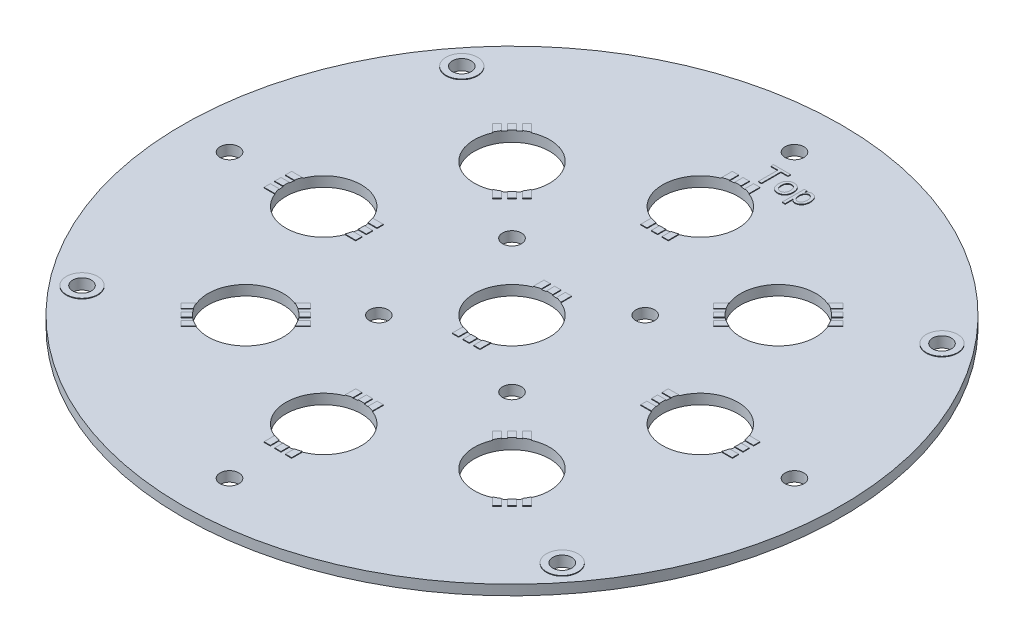
from build123d import *

# Parameters (mm, degrees)
SKETCH2_R                          = 52.5
SKETCH2_R_2                        = 1.5
PCB_1_6MM_BOSS_EXTRUDE1_DEPTH      = 1.6
SKETCH3_W                          = 1
SKETCH3_H                          = 14.6
SKETCH3_W_2                        = 14.6
SKETCH3_H_2                        = 1
PADS_BOSS_EXTRUDE2_DEPTH           = 0.1
LED_HOLES_CUT_EXTRUDE2_REACH       = 76.266
SKETCH4_R                          = 6
SKETCH5_R                          = 2.5
SKETCH5_R_2                        = 1.5
HEATSINK_HOLES_BOSS_EXTRUDE1_DEPTH = 0.1


with BuildPart() as part:
    # Sketch2 → PCB 1.6mm Boss-Extrude1 (new body)
    with BuildSketch(Plane(origin=(0, 0, 0), x_dir=(1, 0, 0), z_dir=(0, 1, 0))):
        with Locations(Location((0, 0, 0), (0, 0, 270))):
            Circle(SKETCH2_R)
        with Locations(Location((-38.25, 30.25, 0), (0, 0, 270))):
            Circle(SKETCH2_R_2, mode=Mode.SUBTRACT)
        with Locations(Location((38.25, 30.25, 0), (0, 0, 270))):
            Circle(SKETCH2_R_2, mode=Mode.SUBTRACT)
        with Locations(Location((38.25, -30.25, 0), (0, 0, 270))):
            Circle(SKETCH2_R_2, mode=Mode.SUBTRACT)
        with Locations(Location((-38.25, -30.25, 0), (0, 0, 270))):
            Circle(SKETCH2_R_2, mode=Mode.SUBTRACT)
        with Locations(Location((0, 45, 0), (0, 0, 270))):
            Circle(SKETCH2_R_2, mode=Mode.SUBTRACT)
        with Locations(Location((45, 0, 0), (0, 0, 270))):
            Circle(SKETCH2_R_2, mode=Mode.SUBTRACT)
        with Locations(Location((0, -45, 0), (0, 0, 270))):
            Circle(SKETCH2_R_2, mode=Mode.SUBTRACT)
        with Locations(Location((-45, 0, 0), (0, 0, 270))):
            Circle(SKETCH2_R_2, mode=Mode.SUBTRACT)
        with Locations(Location((-10.606601718, 10.606601718, 0), (0, 0, 270))):
            Circle(SKETCH2_R_2, mode=Mode.SUBTRACT)
        with Locations(Location((10.606601718, 10.606601718, 0), (0, 0, 270))):
            Circle(SKETCH2_R_2, mode=Mode.SUBTRACT)
        with Locations(Location((10.606601718, -10.606601718, 0), (0, 0, 270))):
            Circle(SKETCH2_R_2, mode=Mode.SUBTRACT)
        with Locations(Location((-10.606601718, -10.606601718, 0), (0, 0, 270))):
            Circle(SKETCH2_R_2, mode=Mode.SUBTRACT)
    extrude(amount=PCB_1_6MM_BOSS_EXTRUDE1_DEPTH)

    # Sketch3 → Pads Boss-Extrude2 (add)
    with BuildSketch(Plane(origin=(0, 1.6, 0), x_dir=(1, 0, 0), z_dir=(0, 1, 0))):
        with Locations((-1.7, 30)):
            Rectangle(SKETCH3_W, SKETCH3_H)
        with Locations((1.7, 30)):
            Rectangle(SKETCH3_W, SKETCH3_H)
        with Locations((-1.7, 0)):
            Rectangle(SKETCH3_W, SKETCH3_H)
        with Locations((1.7, 0)):
            Rectangle(SKETCH3_W, SKETCH3_H)
        with Locations((0, 30)):
            Rectangle(SKETCH3_W, SKETCH3_H)
        Rectangle(SKETCH3_W, SKETCH3_H)
        Polygon((24.81944802, 27.930717857), (14.495689014, 17.606958852), (15.202795796, 16.89985207), (25.526554801, 27.223611076), align=None)
        Polygon((26.021529548, 26.728636329), (15.697770542, 16.404877324), (16.404877324, 15.697770542), (26.728636329, 26.021529548), align=None)
        Polygon((27.223611076, 25.526554801), (16.89985207, 15.202795796), (17.606958852, 14.495689014), (27.930717857, 24.81944802), align=None)
        with Locations((30, 1.7)):
            Rectangle(SKETCH3_W_2, SKETCH3_H_2)
        with Locations((30, 0)):
            Rectangle(SKETCH3_W_2, SKETCH3_H_2)
        with Locations((30, -1.7)):
            Rectangle(SKETCH3_W_2, SKETCH3_H_2)
        Polygon((27.930717857, -24.81944802), (17.606958852, -14.495689014), (16.89985207, -15.202795796), (27.223611076, -25.526554801), align=None)
        Polygon((26.728636329, -26.021529548), (16.404877324, -15.697770542), (15.697770542, -16.404877324), (26.021529548, -26.728636329), align=None)
        Polygon((25.526554801, -27.223611076), (15.202795796, -16.89985207), (14.495689014, -17.606958852), (24.81944802, -27.930717857), align=None)
        with Locations((1.7, -30)):
            Rectangle(SKETCH3_W, SKETCH3_H)
        with Locations((0, -30)):
            Rectangle(SKETCH3_W, SKETCH3_H)
        with Locations((-1.7, -30)):
            Rectangle(SKETCH3_W, SKETCH3_H)
        Polygon((-24.81944802, -27.930717857), (-14.495689014, -17.606958852), (-15.202795796, -16.89985207), (-25.526554801, -27.223611076), align=None)
        Polygon((-26.021529548, -26.728636329), (-15.697770542, -16.404877324), (-16.404877324, -15.697770542), (-26.728636329, -26.021529548), align=None)
        Polygon((-27.223611076, -25.526554801), (-16.89985207, -15.202795796), (-17.606958852, -14.495689014), (-27.930717857, -24.81944802), align=None)
        with Locations((-30, -1.7)):
            Rectangle(SKETCH3_W_2, SKETCH3_H_2)
        with Locations((-30, 0)):
            Rectangle(SKETCH3_W_2, SKETCH3_H_2)
        with Locations((-30, 1.7)):
            Rectangle(SKETCH3_W_2, SKETCH3_H_2)
        Polygon((-27.930717857, 24.81944802), (-17.606958852, 14.495689014), (-16.89985207, 15.202795796), (-27.223611076, 25.526554801), align=None)
        Polygon((-26.728636329, 26.021529548), (-16.404877324, 15.697770542), (-15.697770542, 16.404877324), (-26.021529548, 26.728636329), align=None)
        Polygon((-25.526554801, 27.223611076), (-15.202795796, 16.89985207), (-14.495689014, 17.606958852), (-24.81944802, 27.930717857), align=None)
    extrude(amount=PADS_BOSS_EXTRUDE2_DEPTH)

    # LED Holes Cut-Extrude2: up to this face of the body (flat: up to its plane)
    led_holes_cut_extrude2_end = Plane(part.part.faces().sort_by_distance((-22.415284964, 1.7, -20.011121908))[0])
    # Sketch4 → LED Holes Cut-Extrude2 (cut, up to the picked face)
    with BuildSketch(Plane(origin=(0, 0, 0), x_dir=(1, 0, 0), z_dir=(0, 1, 0)), mode=Mode.PRIVATE) as led_holes_cut_extrude2_sk1:
        with Locations(Location((0, 0, 0), (0, 0, 85.219808153))):
            Circle(SKETCH4_R)
    led_holes_cut_extrude2_tool1 = split(extrude(led_holes_cut_extrude2_sk1.sketch, amount=LED_HOLES_CUT_EXTRUDE2_REACH, mode=Mode.PRIVATE), bisect_by=led_holes_cut_extrude2_end, keep=Keep.BOTH, mode=Mode.PRIVATE)
    # Sketch4 → LED Holes Cut-Extrude2 (cut, up to the picked face)
    with BuildSketch(Plane(origin=(0, 0, 0), x_dir=(1, 0, 0), z_dir=(0, 1, 0)), mode=Mode.PRIVATE) as led_holes_cut_extrude2_sk2:
        with Locations(Location((0, 30, 0), (0, 0, 85.219808153))):
            Circle(SKETCH4_R)
    led_holes_cut_extrude2_tool2 = split(extrude(led_holes_cut_extrude2_sk2.sketch, amount=LED_HOLES_CUT_EXTRUDE2_REACH, mode=Mode.PRIVATE), bisect_by=led_holes_cut_extrude2_end, keep=Keep.BOTH, mode=Mode.PRIVATE)
    # Sketch4 → LED Holes Cut-Extrude2 (cut, up to the picked face)
    with BuildSketch(Plane(origin=(0, 0, 0), x_dir=(1, 0, 0), z_dir=(0, 1, 0)), mode=Mode.PRIVATE) as led_holes_cut_extrude2_sk3:
        with Locations(Location((21.213203436, 21.213203436, 0), (0, 0, 66.510188267))):
            Circle(SKETCH4_R)
    led_holes_cut_extrude2_tool3 = split(extrude(led_holes_cut_extrude2_sk3.sketch, amount=LED_HOLES_CUT_EXTRUDE2_REACH, mode=Mode.PRIVATE), bisect_by=led_holes_cut_extrude2_end, keep=Keep.BOTH, mode=Mode.PRIVATE)
    # Sketch4 → LED Holes Cut-Extrude2 (cut, up to the picked face)
    with BuildSketch(Plane(origin=(0, 0, 0), x_dir=(1, 0, 0), z_dir=(0, 1, 0)), mode=Mode.PRIVATE) as led_holes_cut_extrude2_sk4:
        with Locations(Location((30, 0, 0), (0, 0, 158.489811733))):
            Circle(SKETCH4_R)
    led_holes_cut_extrude2_tool4 = split(extrude(led_holes_cut_extrude2_sk4.sketch, amount=LED_HOLES_CUT_EXTRUDE2_REACH, mode=Mode.PRIVATE), bisect_by=led_holes_cut_extrude2_end, keep=Keep.BOTH, mode=Mode.PRIVATE)
    # Sketch4 → LED Holes Cut-Extrude2 (cut, up to the picked face)
    with BuildSketch(Plane(origin=(0, 0, 0), x_dir=(1, 0, 0), z_dir=(0, 1, 0)), mode=Mode.PRIVATE) as led_holes_cut_extrude2_sk5:
        with Locations(Location((21.213203436, -21.213203436, 0), (0, 0, 113.489811733))):
            Circle(SKETCH4_R)
    led_holes_cut_extrude2_tool5 = split(extrude(led_holes_cut_extrude2_sk5.sketch, amount=LED_HOLES_CUT_EXTRUDE2_REACH, mode=Mode.PRIVATE), bisect_by=led_holes_cut_extrude2_end, keep=Keep.BOTH, mode=Mode.PRIVATE)
    # Sketch4 → LED Holes Cut-Extrude2 (cut, up to the picked face)
    with BuildSketch(Plane(origin=(0, 0, 0), x_dir=(1, 0, 0), z_dir=(0, 1, 0)), mode=Mode.PRIVATE) as led_holes_cut_extrude2_sk6:
        with Locations(Location((0, -30, 0), (0, 0, 94.780191847))):
            Circle(SKETCH4_R)
    led_holes_cut_extrude2_tool6 = split(extrude(led_holes_cut_extrude2_sk6.sketch, amount=LED_HOLES_CUT_EXTRUDE2_REACH, mode=Mode.PRIVATE), bisect_by=led_holes_cut_extrude2_end, keep=Keep.BOTH, mode=Mode.PRIVATE)
    # Sketch4 → LED Holes Cut-Extrude2 (cut, up to the picked face)
    with BuildSketch(Plane(origin=(0, 0, 0), x_dir=(1, 0, 0), z_dir=(0, 1, 0)), mode=Mode.PRIVATE) as led_holes_cut_extrude2_sk7:
        with Locations(Location((-21.213203436, -21.213203436, 0), (0, 0, 66.510188267))):
            Circle(SKETCH4_R)
    led_holes_cut_extrude2_tool7 = split(extrude(led_holes_cut_extrude2_sk7.sketch, amount=LED_HOLES_CUT_EXTRUDE2_REACH, mode=Mode.PRIVATE), bisect_by=led_holes_cut_extrude2_end, keep=Keep.BOTH, mode=Mode.PRIVATE)
    # Sketch4 → LED Holes Cut-Extrude2 (cut, up to the picked face)
    with BuildSketch(Plane(origin=(0, 0, 0), x_dir=(1, 0, 0), z_dir=(0, 1, 0)), mode=Mode.PRIVATE) as led_holes_cut_extrude2_sk8:
        with Locations(Location((-30, 0, 0), (0, 0, 21.510188267))):
            Circle(SKETCH4_R)
    led_holes_cut_extrude2_tool8 = split(extrude(led_holes_cut_extrude2_sk8.sketch, amount=LED_HOLES_CUT_EXTRUDE2_REACH, mode=Mode.PRIVATE), bisect_by=led_holes_cut_extrude2_end, keep=Keep.BOTH, mode=Mode.PRIVATE)
    # Sketch4 → LED Holes Cut-Extrude2 (cut, up to the picked face)
    with BuildSketch(Plane(origin=(0, 0, 0), x_dir=(1, 0, 0), z_dir=(0, 1, 0)), mode=Mode.PRIVATE) as led_holes_cut_extrude2_sk9:
        with Locations(Location((-21.213203436, 21.213203436, 0), (0, 0, 113.489811733))):
            Circle(SKETCH4_R)
    led_holes_cut_extrude2_tool9 = split(extrude(led_holes_cut_extrude2_sk9.sketch, amount=LED_HOLES_CUT_EXTRUDE2_REACH, mode=Mode.PRIVATE), bisect_by=led_holes_cut_extrude2_end, keep=Keep.BOTH, mode=Mode.PRIVATE)
    add(led_holes_cut_extrude2_tool1.solids().sort_by(Axis((0, 0, 0), (0, 1, 0)))[0], mode=Mode.SUBTRACT)
    add(led_holes_cut_extrude2_tool2.solids().sort_by(Axis((0, 0, -30), (0, 1, 0)))[0], mode=Mode.SUBTRACT)
    add(led_holes_cut_extrude2_tool3.solids().sort_by(Axis((21.213203, 0, -21.213203), (0, 1, 0)))[0], mode=Mode.SUBTRACT)
    add(led_holes_cut_extrude2_tool4.solids().sort_by(Axis((30, 0, 0), (0, 1, 0)))[0], mode=Mode.SUBTRACT)
    add(led_holes_cut_extrude2_tool5.solids().sort_by(Axis((21.213203, 0, 21.213203), (0, 1, 0)))[0], mode=Mode.SUBTRACT)
    add(led_holes_cut_extrude2_tool6.solids().sort_by(Axis((0, 0, 30), (0, 1, 0)))[0], mode=Mode.SUBTRACT)
    add(led_holes_cut_extrude2_tool7.solids().sort_by(Axis((-21.213203, 0, 21.213203), (0, 1, 0)))[0], mode=Mode.SUBTRACT)
    add(led_holes_cut_extrude2_tool8.solids().sort_by(Axis((-30, 0, 0), (0, 1, 0)))[0], mode=Mode.SUBTRACT)
    add(led_holes_cut_extrude2_tool9.solids().sort_by(Axis((-21.213203, 0, -21.213203), (0, 1, 0)))[0], mode=Mode.SUBTRACT)

    # Sketch5 → Heatsink Holes Boss-Extrude1 (add)
    # profile 1 of 7: a face of its own
    with BuildSketch(Plane(origin=(0, 1.6, 0), x_dir=(1, 0, 0), z_dir=(0, 1, 0))):
        with Locations(Location((-38.25, 30.25, 0), (0, 0, 90))):
            Circle(SKETCH5_R)
        with Locations(Location((-38.25, 30.25, 0), (0, 0, 90))):
            Circle(SKETCH5_R_2, mode=Mode.SUBTRACT)
    # profile 2 of 7: a face of its own
    with BuildSketch(Plane(origin=(0, 1.6, 0), x_dir=(1, 0, 0), z_dir=(0, 1, 0))):
        with Locations(Location((38.25, 30.25, 0), (0, 0, 90))):
            Circle(SKETCH5_R)
        with Locations(Location((38.25, 30.25, 0), (0, 0, 90))):
            Circle(SKETCH5_R_2, mode=Mode.SUBTRACT)
    # profile 3 of 7: a face of its own
    with BuildSketch(Plane(origin=(0, 1.6, 0), x_dir=(1, 0, 0), z_dir=(0, 1, 0))):
        with Locations(Location((38.25, -30.25, 0), (0, 0, 90))):
            Circle(SKETCH5_R)
        with Locations(Location((38.25, -30.25, 0), (0, 0, 90))):
            Circle(SKETCH5_R_2, mode=Mode.SUBTRACT)
    # profile 4 of 7: a face of its own
    with BuildSketch(Plane(origin=(0, 1.6, 0), x_dir=(1, 0, 0), z_dir=(0, 1, 0))):
        with Locations(Location((-38.25, -30.25, 0), (0, 0, 90))):
            Circle(SKETCH5_R)
        with Locations(Location((-38.25, -30.25, 0), (0, 0, 90))):
            Circle(SKETCH5_R_2, mode=Mode.SUBTRACT)
    # profile 5 of 7: a face of its own
    with BuildSketch(Plane(origin=(0, 1.6, 0), x_dir=(1, 0, 0), z_dir=(0, 1, 0))):
        Polygon((1.256410256, 38), (1.256410256, 41.096153846), (0.134615385, 41.096153846), (0.134615385, 41.5), (2.871794872, 41.5), (2.871794872, 41.096153846), (1.75, 41.096153846), (1.75, 38), align=None)
    # profile 6 of 7: a face of its own
    with BuildSketch(Plane(origin=(0, 1.6, 0), x_dir=(1, 0, 0), z_dir=(0, 1, 0))):
        with BuildLine():
            add(Edge.make_bspline(
                [(3.185897436, 39.278846154), (3.187153931, 39.335681053), (3.189585341, 39.445660732), (3.206996397, 39.605249716), (3.236846383, 39.753411182), (3.278736745, 39.890284286), (3.332909285, 40.015912153), (3.399832611, 40.129589933), (3.477660992, 40.233406085), (3.539772475, 40.292087598), (3.570813301, 40.321414263)],
                knots=[0, 0, 0, 0, 1.189940866, 2.302622481, 3.356378305, 4.350088409, 5.294652018, 6.213657312, 7.107257627, 8, 8, 8, 8], degree=3))
            add(Edge.make_bspline(
                [(3.570813301, 40.321414263), (3.597962598, 40.343952074), (3.651765814, 40.388616461), (3.739582658, 40.445257871), (3.831009767, 40.493922561), (3.926855021, 40.53427302), (4.027421333, 40.565102231), (4.132395545, 40.586499079), (4.241643483, 40.600478137), (4.316061579, 40.601860167), (4.353966346, 40.602564103)],
                knots=[0, 0, 0, 0, 0.994414631, 1.970684744, 2.940793954, 3.912782355, 4.898970837, 5.902128985, 6.931451948, 8, 8, 8, 8], degree=3))
            add(Edge.make_bspline(
                [(4.353966346, 40.602564103), (4.395837781, 40.601382766), (4.477767004, 40.599071262), (4.597993734, 40.583997733), (4.711840201, 40.555985765), (4.820772311, 40.519273224), (4.923140577, 40.470347594), (5.020561864, 40.412018211), (5.110650696, 40.341327699), (5.195133689, 40.261425459), (5.271347156, 40.172068443), (5.337747441, 40.073695704), (5.393978987, 39.967157028), (5.440429341, 39.852351412), (5.476051934, 39.729198601), (5.500881789, 39.597961777), (5.516787975, 39.45895882), (5.518403451, 39.363493264), (5.519230769, 39.314603365)],
                knots=[0, 0, 0, 0, 1.026363227, 2.008269884, 2.962742747, 3.895658536, 4.820662428, 5.738204837, 6.673158329, 7.621267452, 8.584296177, 9.545483285, 10.524327568, 11.531652541, 12.575780624, 13.660990097, 14.802144351, 16, 16, 16, 16], degree=3))
            add(Edge.make_bspline(
                [(5.519230769, 39.314603365), (5.51891905, 39.274861082), (5.518313422, 39.197647147), (5.510992764, 39.085139774), (5.499930138, 38.979158347), (5.484873652, 38.879582247), (5.464591839, 38.786571134), (5.439300143, 38.700199687), (5.409969318, 38.62000144), (5.376258854, 38.545890793), (5.337793825, 38.477269074), (5.295889075, 38.412657253), (5.249491203, 38.352153353), (5.198659687, 38.295857645), (5.144080461, 38.243361849), (5.085381132, 38.194466957), (5.022453346, 38.149876889), (4.933611857, 38.095738593), (4.816352148, 38.03900753), (4.667836855, 37.990390204), (4.512895991, 37.960758241), (4.407381303, 37.957020414), (4.353966346, 37.955128205)],
                knots=[0, 0, 0, 0, 1.174068422, 2.28105775, 3.329581501, 4.321819531, 5.255045276, 6.14001734, 6.978936381, 7.776151739, 8.542754425, 9.301196708, 10.049767304, 10.792968067, 11.540167917, 12.285482871, 13.048063169, 13.816653646, 15.357768987, 16.884132754, 18.422646949, 20, 20, 20, 20], degree=3))
            add(Edge.make_bspline(
                [(4.353966346, 37.955128205), (4.311386694, 37.956283024), (4.228046383, 37.958543327), (4.106119247, 37.973965066), (3.990402954, 38.000390337), (3.88124656, 38.038899274), (3.777677197, 38.086170818), (3.680673578, 38.145182016), (3.590048265, 38.214647063), (3.506601614, 38.295014105), (3.430303461, 38.384492414), (3.365173306, 38.48500325), (3.309429854, 38.594473521), (3.263887554, 38.713375345), (3.22909959, 38.841712301), (3.204117551, 38.979146531), (3.188326482, 39.125866975), (3.186721911, 39.226921436), (3.185897436, 39.278846154)],
                knots=[0, 0, 0, 0, 1.022681766, 2.001674804, 2.94671416, 3.868132449, 4.777362857, 5.676573364, 6.589418535, 7.514523194, 8.454681358, 9.407574523, 10.384198733, 11.400667853, 12.460217505, 13.573389442, 14.753137007, 16, 16, 16, 16], degree=3))
        make_face()
        with BuildLine():
            add(Edge.make_bspline(
                [(3.634615385, 39.280248397), (3.63537689, 39.24283954), (3.636849895, 39.170478403), (3.645640881, 39.065448833), (3.661700394, 38.967941557), (3.684042869, 38.877602327), (3.712699728, 38.794418331), (3.74782191, 38.718248735), (3.789026238, 38.649028969), (3.83720681, 38.587887475), (3.889643692, 38.53384518), (3.946201232, 38.487229419), (4.006092888, 38.44764683), (4.069420446, 38.41537233), (4.135897131, 38.389872576), (4.205667576, 38.371512288), (4.278855512, 38.360969765), (4.328692556, 38.359645786), (4.353966346, 38.358974359)],
                knots=[0, 0, 0, 0, 1.36128903, 2.633184439, 3.831299874, 4.953299848, 6.015607462, 7.027679361, 8.000438392, 8.93945591, 9.853536715, 10.73548639, 11.60109037, 12.460616037, 13.316600729, 14.187036799, 15.080594522, 16, 16, 16, 16], degree=3))
            add(Edge.make_bspline(
                [(4.353966346, 38.358974359), (4.379022952, 38.359546959), (4.428462139, 38.360676757), (4.50069733, 38.372638004), (4.570217401, 38.389797613), (4.636447971, 38.415117614), (4.698837983, 38.448516994), (4.758596441, 38.488024028), (4.814512061, 38.535321811), (4.867548857, 38.589260557), (4.915040991, 38.65130421), (4.957640121, 38.72024984), (4.992640407, 38.797656548), (5.020935785, 38.882338994), (5.043525694, 38.974477474), (5.05951042, 39.074107173), (5.068250071, 39.181467404), (5.069743594, 39.25546028), (5.070512821, 39.293569712)],
                knots=[0, 0, 0, 0, 0.904535546, 1.784739026, 2.638791991, 3.488785886, 4.338695884, 5.191202824, 6.07237792, 6.980061329, 7.919174549, 8.889507933, 9.902165842, 10.981000531, 12.111539881, 13.326270405, 14.622917219, 16, 16, 16, 16], degree=3))
            add(Edge.make_bspline(
                [(5.070512821, 39.293569712), (5.06973711, 39.329575153), (5.068228479, 39.399599873), (5.059535893, 39.501385645), (5.043269967, 39.596267749), (5.021362027, 39.684513624), (4.991331669, 39.765396614), (4.956825739, 39.840450098), (4.914226522, 39.908185507), (4.865898203, 39.968984903), (4.813149871, 40.02309241), (4.757093296, 40.070577301), (4.697144545, 40.109573488), (4.634747859, 40.142726737), (4.568892681, 40.167498439), (4.500201356, 40.186236575), (4.428144629, 40.196744129), (4.379005653, 40.198051675), (4.353966346, 40.198717949)],
                knots=[0, 0, 0, 0, 1.329905342, 2.586449315, 3.768451236, 4.882143757, 5.938857988, 6.950440627, 7.927559667, 8.885972819, 9.813736587, 10.714405609, 11.592966897, 12.450023853, 13.318821862, 14.185602452, 15.075453733, 16, 16, 16, 16], degree=3))
            add(Edge.make_bspline(
                [(4.353966346, 40.198717949), (4.328694703, 40.198040947), (4.278861893, 40.196705975), (4.205643153, 40.186243433), (4.136065415, 40.167611582), (4.069249985, 40.143223581), (4.006156247, 40.110638858), (3.945917739, 40.071273576), (3.89013785, 40.023774691), (3.836907727, 39.970568157), (3.789279915, 39.909419754), (3.74779514, 39.840895629), (3.71256001, 39.765202029), (3.684063372, 39.682185975), (3.661694457, 39.591856283), (3.645642233, 39.494346212), (3.636870601, 39.389550427), (3.635382412, 39.317423402), (3.634615385, 39.280248397)],
                knots=[0, 0, 0, 0, 0.920966903, 1.816042154, 2.687956485, 3.542385364, 4.403370762, 5.270444796, 6.159337503, 7.068888003, 8.009500254, 8.976623456, 9.982690403, 11.046802133, 12.170707598, 13.370857791, 14.644913259, 16, 16, 16, 16], degree=3))
        make_face(mode=Mode.SUBTRACT)
    # profile 7 of 7: a face of its own
    with BuildSketch(Plane(origin=(0, 1.6, 0), x_dir=(1, 0, 0), z_dir=(0, 1, 0))):
        with BuildLine():
            Line((6.012820513, 37.057692308), (6.012820513, 40.557692308))
            Line((6.012820513, 40.557692308), (6.461538462, 40.557692308))
            Line((6.461538462, 40.557692308), (6.461538462, 40.151742788))
            add(Edge.make_bspline(
                [(6.461538462, 40.151742788), (6.484043949, 40.187458323), (6.527397555, 40.256259197), (6.600418621, 40.34910238), (6.678776204, 40.426791379), (6.761667147, 40.491667386), (6.852364599, 40.541393752), (6.950980702, 40.577661128), (7.058931508, 40.598835401), (7.133819419, 40.601294655), (7.172475962, 40.602564103)],
                knots=[0, 0, 0, 0, 1.141868254, 2.199646056, 3.187916027, 4.121412168, 5.038483649, 5.974824485, 6.95462054, 8, 8, 8, 8], degree=3))
            add(Edge.make_bspline(
                [(7.172475962, 40.602564103), (7.19820403, 40.601991206), (7.249073774, 40.600858469), (7.324260574, 40.592873073), (7.397456128, 40.580494092), (7.46831855, 40.562305921), (7.53646864, 40.538348207), (7.602141788, 40.509153039), (7.666052428, 40.475882877), (7.72706173, 40.436367819), (7.784839325, 40.392162746), (7.840217444, 40.34470517), (7.890483331, 40.29137261), (7.938387844, 40.234939513), (7.9819472, 40.173686257), (8.021226275, 40.107774892), (8.057675215, 40.038177044), (8.100593087, 39.938959156), (8.146171971, 39.808811695), (8.183214605, 39.644569528), (8.207370127, 39.473539807), (8.210134214, 39.35698841), (8.211538462, 39.297776442)],
                knots=[0, 0, 0, 0, 0.824202902, 1.629620634, 2.419929953, 3.200854495, 3.970497378, 4.731532444, 5.501903467, 6.276628953, 7.056871135, 7.831705169, 8.610184821, 9.402088757, 10.202023236, 11.014889876, 11.858855485, 12.71721399, 14.476656902, 16.267557585, 18.103795699, 20, 20, 20, 20], degree=3))
            add(Edge.make_bspline(
                [(8.211538462, 39.297776442), (8.210053785, 39.234582466), (8.207148192, 39.110908362), (8.18050979, 38.930171029), (8.137193772, 38.759058999), (8.08670329, 38.624068429), (8.038304093, 38.522527326), (7.997270008, 38.451594069), (7.95326921, 38.384909526), (7.905364153, 38.322467064), (7.85256684, 38.265282392), (7.796602348, 38.211820195), (7.736740911, 38.163044682), (7.652276783, 38.106009818), (7.542307951, 38.046277415), (7.40487367, 37.993343228), (7.263447085, 37.961399186), (7.167725489, 37.957217742), (7.119891827, 37.955128205)],
                knots=[0, 0, 0, 0, 1.566750505, 3.066217315, 4.520030908, 5.938083948, 6.632957415, 7.30813415, 7.968947793, 8.613647255, 9.257851326, 9.897527079, 10.532192309, 11.170526994, 12.423402314, 13.627070148, 14.814207778, 16, 16, 16, 16], degree=3))
            add(Edge.make_bspline(
                [(7.119891827, 37.955128205), (7.085191914, 37.956186112), (7.017308882, 37.958255681), (6.918388012, 37.979155969), (6.824487353, 38.010711968), (6.737613367, 38.057319067), (6.657283122, 38.112535191), (6.58419841, 38.175269873), (6.517944352, 38.244263786), (6.480391441, 38.295427611), (6.461538462, 38.321113782)],
                knots=[0, 0, 0, 0, 1.060500719, 2.074645059, 3.081194601, 4.082546779, 5.08044464, 6.05947861, 7.025785017, 8, 8, 8, 8], degree=3))
            Line((6.461538462, 38.321113782), (6.461538462, 37.057692308))
            Line((6.461538462, 37.057692308), (6.012820513, 37.057692308))
        make_face()
        with BuildLine():
            add(Edge.make_bspline(
                [(6.461538462, 39.2578125), (6.461971116, 39.220631581), (6.462807916, 39.148719742), (6.472196424, 39.044756985), (6.486655262, 38.948452552), (6.506734705, 38.859439721), (6.533321425, 38.778007218), (6.565490385, 38.703904001), (6.603512561, 38.637130908), (6.64764749, 38.578273372), (6.696561002, 38.527334987), (6.746894582, 38.481795921), (6.800432274, 38.443909976), (6.856247292, 38.412586498), (6.914873454, 38.388509241), (6.976171131, 38.372032381), (7.039561555, 38.360879318), (7.082684378, 38.359613676), (7.104467147, 38.358974359)],
                knots=[0, 0, 0, 0, 1.437434546, 2.78015081, 4.032764778, 5.2012756, 6.304456418, 7.34047555, 8.320212436, 9.269161424, 10.176980179, 11.047598006, 11.89018243, 12.707424221, 13.518042872, 14.333683991, 15.158288469, 16, 16, 16, 16], degree=3))
            add(Edge.make_bspline(
                [(7.104467147, 38.358974359), (7.126704667, 38.359656287), (7.17073167, 38.361006404), (7.235590366, 38.371524352), (7.297435115, 38.390217077), (7.357289662, 38.41463893), (7.41388082, 38.447572705), (7.469268291, 38.485932332), (7.520972636, 38.533020625), (7.571078289, 38.586026743), (7.616806625, 38.647073483), (7.656150571, 38.716390015), (7.688880957, 38.793471332), (7.71634573, 38.877874205), (7.737017265, 38.970418147), (7.75229626, 39.07042403), (7.761519004, 39.178412494), (7.762376364, 39.252885898), (7.762820513, 39.291466346)],
                knots=[0, 0, 0, 0, 0.83316913, 1.649551805, 2.453198062, 3.250183293, 4.066002037, 4.901882611, 5.770302609, 6.681184977, 7.632314019, 8.620852534, 9.660448002, 10.765528849, 11.942537832, 13.209677882, 14.554492318, 16, 16, 16, 16], degree=3))
            add(Edge.make_bspline(
                [(7.762820513, 39.291466346), (7.762379076, 39.328179207), (7.761522841, 39.399389493), (7.752195328, 39.502427304), (7.737536516, 39.598458066), (7.717712468, 39.687514883), (7.691048607, 39.769511357), (7.657990127, 39.844130714), (7.6194549, 39.911979832), (7.575076217, 39.972340999), (7.526896286, 40.025436971), (7.475804349, 40.071538586), (7.422929703, 40.110901757), (7.367270381, 40.142792442), (7.309715262, 40.168616622), (7.249199779, 40.18568296), (7.186676675, 40.196836367), (7.144246591, 40.198084182), (7.122696314, 40.198717949)],
                knots=[0, 0, 0, 0, 1.417753527, 2.749952742, 3.99222208, 5.168205227, 6.27013346, 7.316877701, 8.315654914, 9.278031164, 10.204687429, 11.080340169, 11.932552405, 12.745464952, 13.553904146, 14.362393741, 15.168258362, 16, 16, 16, 16], degree=3))
            add(Edge.make_bspline(
                [(7.122696314, 40.198717949), (7.101144513, 40.198112246), (7.058440669, 40.196912075), (6.995544739, 40.185216862), (6.934735633, 40.166293717), (6.87619846, 40.139053709), (6.818998071, 40.10518855), (6.763498431, 40.063868182), (6.710823763, 40.013883572), (6.659758226, 39.957662509), (6.612803667, 39.894037721), (6.571877166, 39.823286585), (6.537538103, 39.745670012), (6.509588461, 39.661109565), (6.487995731, 39.569824043), (6.473010626, 39.47180721), (6.462614254, 39.367176549), (6.461904261, 39.294999308), (6.461538462, 39.2578125)],
                knots=[0, 0, 0, 0, 0.806892931, 1.598819005, 2.388223016, 3.187667544, 4.012236564, 4.875742748, 5.774202643, 6.729148108, 7.718801443, 8.731210163, 9.785807378, 10.893572366, 12.063989118, 13.296455458, 14.607092894, 16, 16, 16, 16], degree=3))
        make_face(mode=Mode.SUBTRACT)
    extrude(amount=HEATSINK_HOLES_BOSS_EXTRUDE1_DEPTH)


solid = part.part
